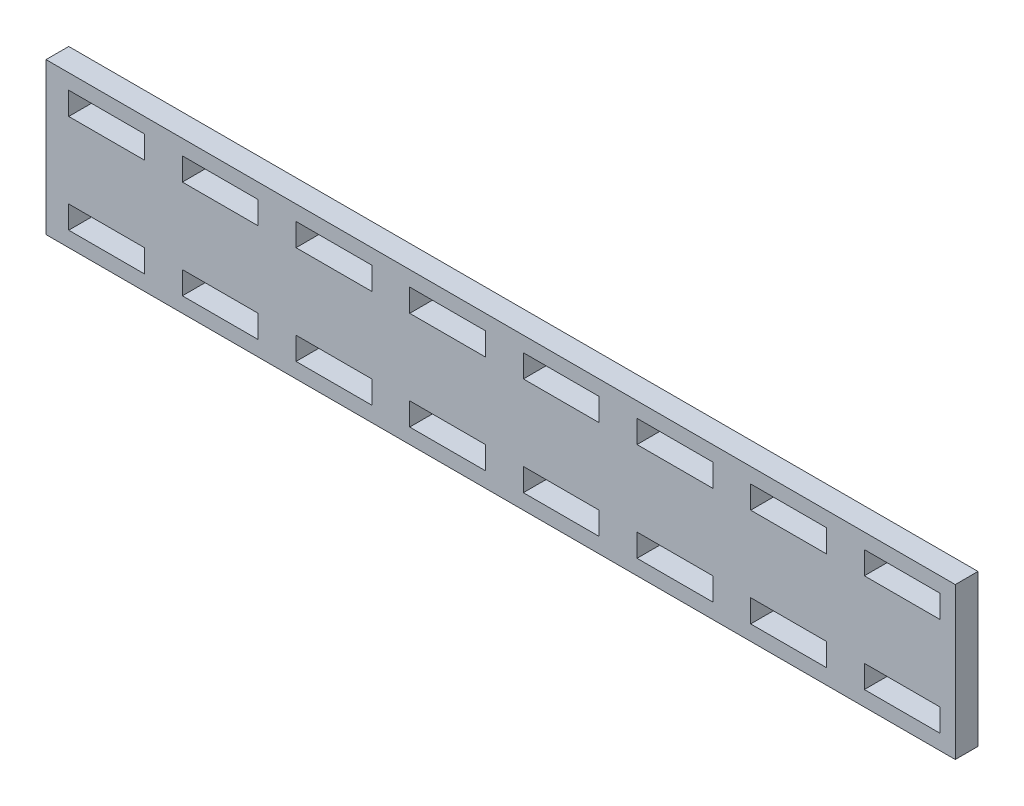
from build123d import *

# Parameters (mm, degrees)
SKETCH_1_W      = 10
SKETCH_1_H      = 3
EXTRUDE_1_DEPTH = 3


with BuildPart() as part:
    # 草图1 → 凸台-拉伸1 (new body)
    with BuildSketch(Plane.XY):
        Polygon((-53, 5), (-53, -5), (-53, -10), (67, -10), (67, -5), (67, 5), (67, 10), (-53, 10), align=None)
        with Locations((-30, 6.5)):
            Rectangle(SKETCH_1_W, SKETCH_1_H, mode=Mode.SUBTRACT)
        with Locations((-45, 6.5)):
            Rectangle(SKETCH_1_W, SKETCH_1_H, mode=Mode.SUBTRACT)
        with Locations((-15, 6.5)):
            Rectangle(SKETCH_1_W, SKETCH_1_H, mode=Mode.SUBTRACT)
        with Locations((0, 6.5)):
            Rectangle(SKETCH_1_W, SKETCH_1_H, mode=Mode.SUBTRACT)
        with Locations((15, 6.5)):
            Rectangle(SKETCH_1_W, SKETCH_1_H, mode=Mode.SUBTRACT)
        with Locations((30, 6.5)):
            Rectangle(SKETCH_1_W, SKETCH_1_H, mode=Mode.SUBTRACT)
        with Locations((45, 6.5)):
            Rectangle(SKETCH_1_W, SKETCH_1_H, mode=Mode.SUBTRACT)
        with Locations((45, -6.5)):
            Rectangle(SKETCH_1_W, SKETCH_1_H, mode=Mode.SUBTRACT)
        with Locations((30, -6.5)):
            Rectangle(SKETCH_1_W, SKETCH_1_H, mode=Mode.SUBTRACT)
        with Locations((15, -6.5)):
            Rectangle(SKETCH_1_W, SKETCH_1_H, mode=Mode.SUBTRACT)
        with Locations((0, -6.5)):
            Rectangle(SKETCH_1_W, SKETCH_1_H, mode=Mode.SUBTRACT)
        with Locations((-15, -6.5)):
            Rectangle(SKETCH_1_W, SKETCH_1_H, mode=Mode.SUBTRACT)
        with Locations((-30, -6.5)):
            Rectangle(SKETCH_1_W, SKETCH_1_H, mode=Mode.SUBTRACT)
        with Locations((-45, -6.5)):
            Rectangle(SKETCH_1_W, SKETCH_1_H, mode=Mode.SUBTRACT)
        with Locations((60, 6.5)):
            Rectangle(SKETCH_1_W, SKETCH_1_H, mode=Mode.SUBTRACT)
        with Locations((60, -6.5)):
            Rectangle(SKETCH_1_W, SKETCH_1_H, mode=Mode.SUBTRACT)
    extrude(amount=EXTRUDE_1_DEPTH)


solid = part.part
